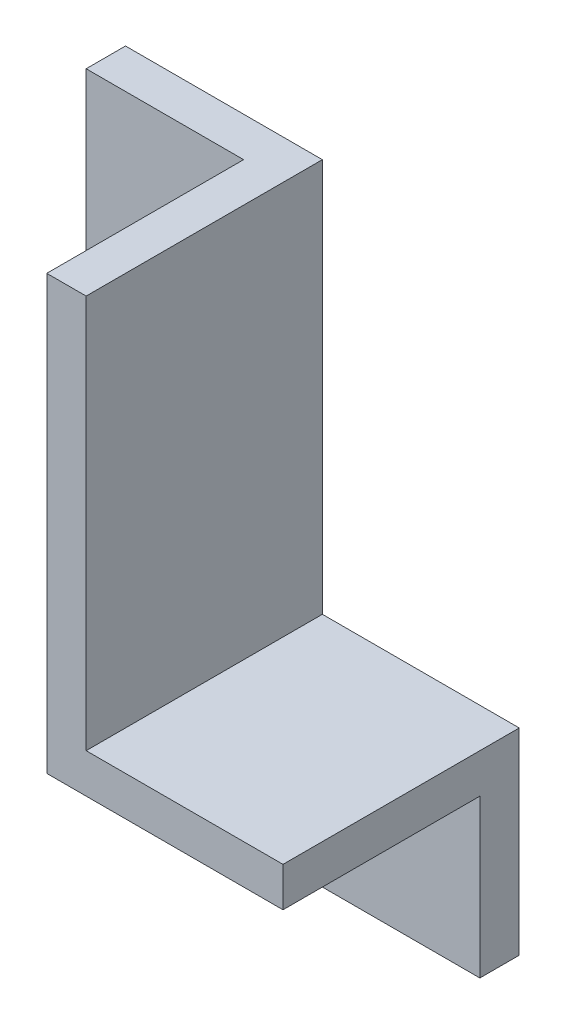
from build123d import *

# Parameters (mm, degrees)
BOSS_EXTRUDE1_DEPTH = 10
BOSS_EXTRUDE2_DEPTH = 50


with BuildPart() as part:
    # Sketch1 → Boss-Extrude1 (new body)
    with BuildSketch(Plane.XY):
        Polygon((0, 150), (50, 150), (50, 50), (100, 50), (100, 0), (0, 0), align=None)
    extrude(amount=BOSS_EXTRUDE1_DEPTH)

    # Sketch2 → Boss-Extrude2 (add)
    with BuildSketch(Plane.XY.offset(10)):
        Polygon((40, 150), (40, 40), (100, 40), (100, 50), (50, 50), (50, 150), align=None)
    extrude(amount=BOSS_EXTRUDE2_DEPTH)

    # Sketch3 → CBORE for #10 Binding Head Machine Screw1 (revolve, cut)
    with BuildSketch(Plane(origin=(25.416829558, 24.242970072, 10), x_dir=(0, -1, 0), z_dir=(1, 0, 0))):
        Polygon((0, 0), (0, 10), (2.5527, 10), (2.5527, 3.1242), (5.55625, 3.1242), (5.55625, 0.635), (6.19125, 0), align=None)
    revolve(axis=Axis((25.416829558, 24.242970072, 16.35), (0, 0, -1)), mode=Mode.SUBTRACT)


solid = part.part
